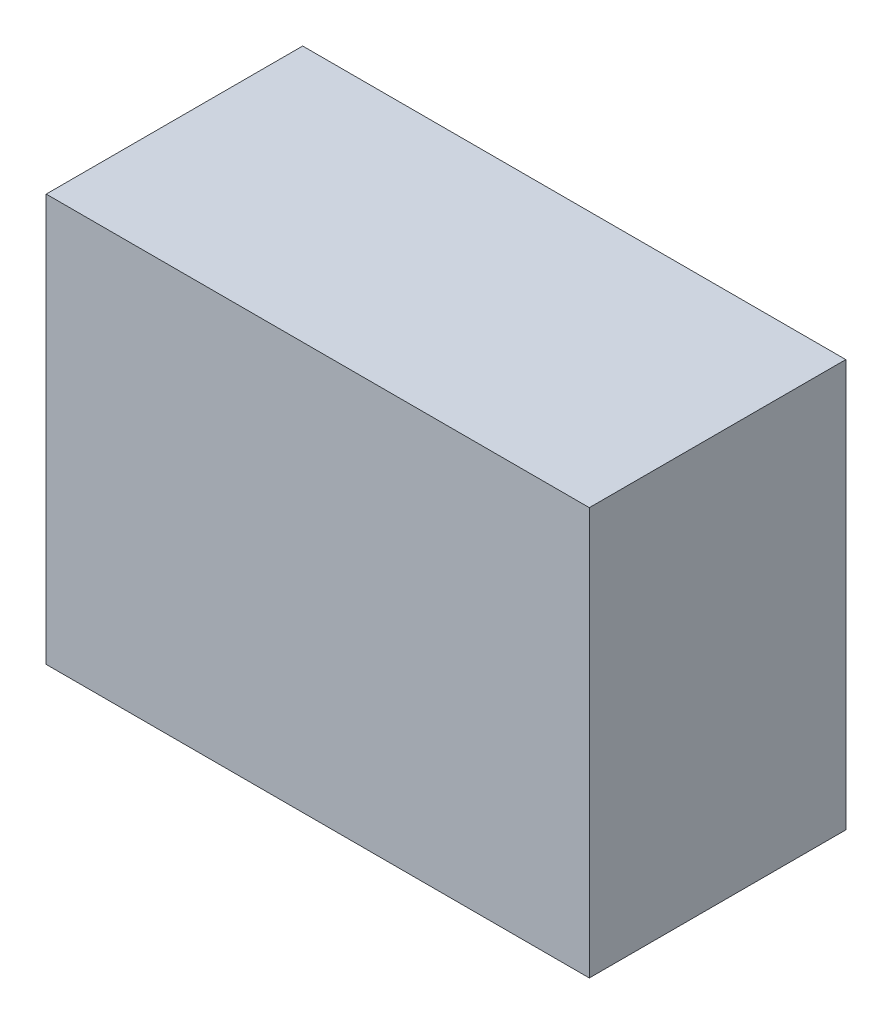
from build123d import *

# Parameters (mm, degrees)
SKETCH_1_W      = 72
SKETCH_1_H      = 34
EXTRUDE_1_DEPTH = 54


with BuildPart() as part:
    # 草图1 → 凸台-拉伸1 (new body)
    with BuildSketch(Plane(origin=(0, 0, 0), x_dir=(1, 0, 0), z_dir=(0, 1, 0))):
        Rectangle(SKETCH_1_W, SKETCH_1_H)
    extrude(amount=EXTRUDE_1_DEPTH)


solid = part.part
